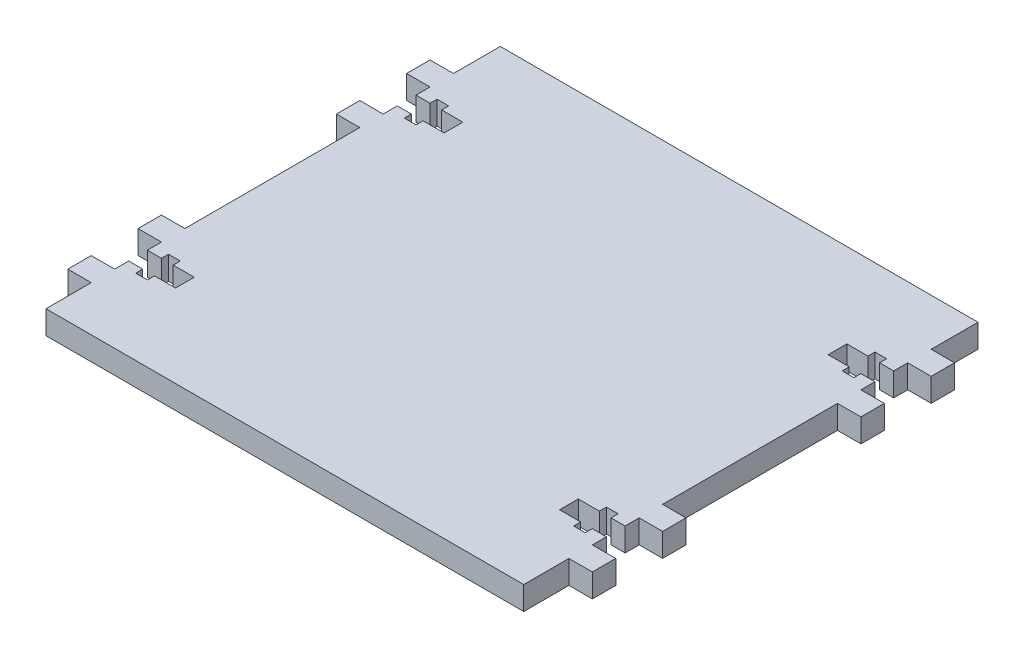
from build123d import *

# Parameters (mm, degrees)
BOSS_EXTRUDE3_DEPTH = 5


with BuildPart() as part:
    # Sketch2 → Boss-Extrude3 (new body)
    with BuildSketch(Plane(origin=(0, 0, 0), x_dir=(1, 0, 0), z_dir=(0, 1, 0))):
        Polygon((125.566090761, 54.865104149), (125.566090761, 51.865104149), (122.566090761, 51.865104149), (122.566090761, 53.365104149), (120.066090761, 53.365104149), (120.066090761, 51.865104149), (115.566090761, 51.865104149), (115.566090761, 47.865104149), (120.066090761, 47.865104149), (120.066090761, 46.365104149), (122.566090761, 46.365104149), (122.566090761, 47.865104149), (125.566090761, 47.865104149), (125.566090761, 44.865104149), (130.566090761, 44.865104149), (130.566090761, 39.865104149), (125.566090761, 39.865104149), (125.566090761, 2.519066104), (130.566090761, 2.519066104), (130.566090761, -2.480933896), (125.566090761, -2.480933896), (125.566090761, -5.480933896), (122.566090761, -5.480933896), (122.566090761, -3.980933896), (120.066090761, -3.980933896), (120.066090761, -5.480933896), (115.566090761, -5.480933896), (115.566090761, -9.480933896), (120.066090761, -9.480933896), (120.066090761, -10.980933896), (122.566090761, -10.980933896), (122.566090761, -9.480933896), (125.566090761, -9.480933896), (125.566090761, -12.480933896), (130.566090761, -12.480933896), (130.566090761, -17.480933896), (125.566090761, -17.480933896), (125.566090761, -27.134895851), (23.566090761, -27.134895851), (23.566090761, -17.480933896), (18.566090761, -17.480933896), (18.566090761, -12.480933896), (23.566090761, -12.480933896), (23.566090761, -9.480933896), (26.566090761, -9.480933896), (26.566090761, -10.980933896), (29.066090761, -10.980933896), (29.066090761, -9.480933896), (33.566090761, -9.480933896), (33.566090761, -5.480933896), (29.066090761, -5.480933896), (29.066090761, -3.980933896), (26.566090761, -3.980933896), (26.566090761, -5.480933896), (23.566090761, -5.480933896), (23.566090761, -2.480933896), (18.566090761, -2.480933896), (18.566090761, 2.519066104), (23.566090761, 2.519066104), (23.566090761, 39.865104149), (18.566090761, 39.865104149), (18.566090761, 44.865104149), (23.566090761, 44.865104149), (23.566090761, 47.865104149), (26.566090761, 47.865104149), (26.566090761, 46.365104149), (29.066090761, 46.365104149), (29.066090761, 47.865104149), (33.566090761, 47.865104149), (33.566090761, 51.865104149), (29.066090761, 51.865104149), (29.066090761, 53.365104149), (26.566090761, 53.365104149), (26.566090761, 51.865104149), (23.566090761, 51.865104149), (23.566090761, 54.865104149), (18.566090761, 54.865104149), (18.566090761, 59.865104149), (23.566090761, 59.865104149), (23.566090761, 69.865104149), (125.566090761, 69.865104149), (125.566090761, 59.865104149), (130.566090761, 59.865104149), (130.566090761, 54.865104149), align=None)
    extrude(amount=BOSS_EXTRUDE3_DEPTH)


solid = part.part
